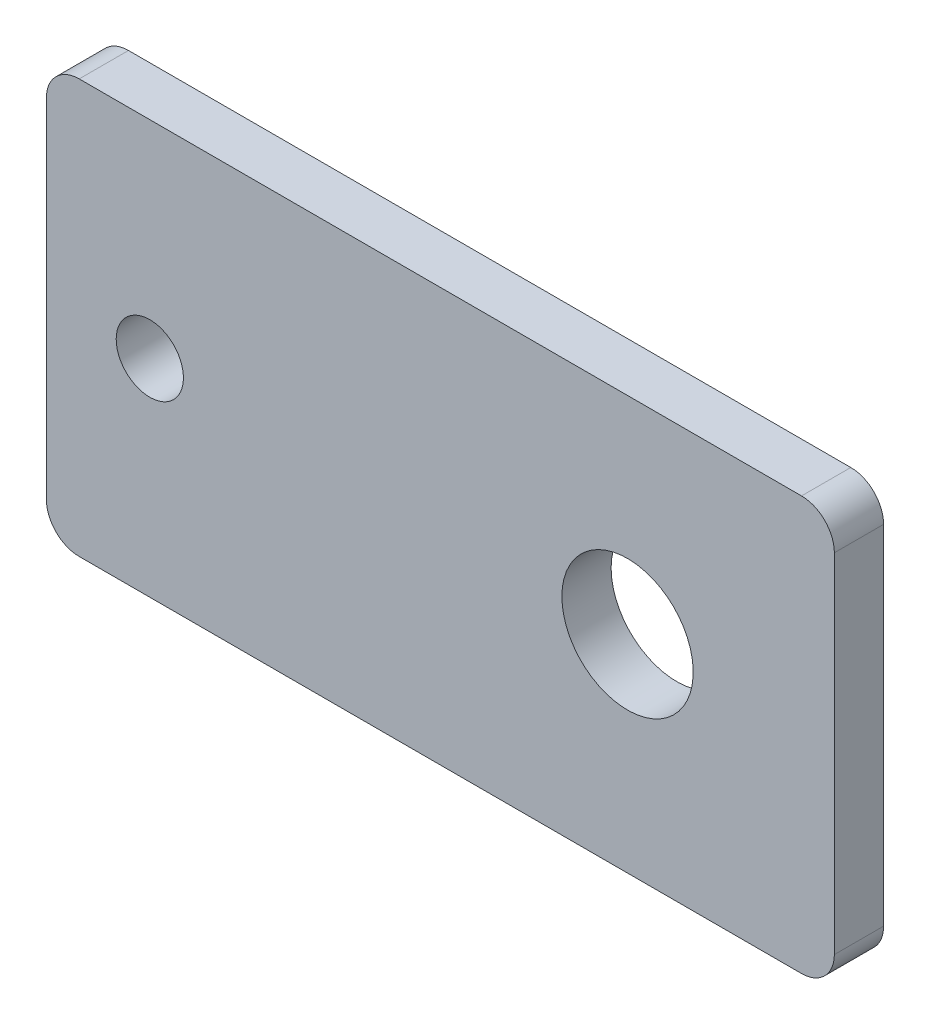
from build123d import *

# Parameters (mm, degrees)
SKETCH1_W           = 76.2
SKETCH1_H           = 40
SKETCH1_R           = 6.35
SKETCH1_R_2         = 3.25
BOSS_EXTRUDE1_DEPTH = 4.7625
FILLET1_R           = 3.175


with BuildPart() as part:
    # Sketch1 → Boss-Extrude1 (new body)
    with BuildSketch(Plane.XY):
        with Locations((203.649963425, -18.100025364)):
            Rectangle(SKETCH1_W, SKETCH1_H)
        with Locations(Location((221.749963425, -18.100025364, 0), (0, 0, 180))):
            Circle(SKETCH1_R, mode=Mode.SUBTRACT)
        with Locations(Location((175.549963425, -18.100025364, 0), (0, 0, 180))):
            Circle(SKETCH1_R_2, mode=Mode.SUBTRACT)
    extrude(amount=BOSS_EXTRUDE1_DEPTH)

    # Fillet1
    fillet1_edges = [part.edges().sort_by_distance(p)[0] for p in [
        (241.749963425, -38.100025364, 2.38125),
        (165.549963425, -38.100025364, 2.38125),
        (165.549963425, 1.899974636, 2.38125),
        (241.749963425, 1.899974636, 2.38125),
    ]]
    fillet(fillet1_edges, radius=FILLET1_R)


solid = part.part
